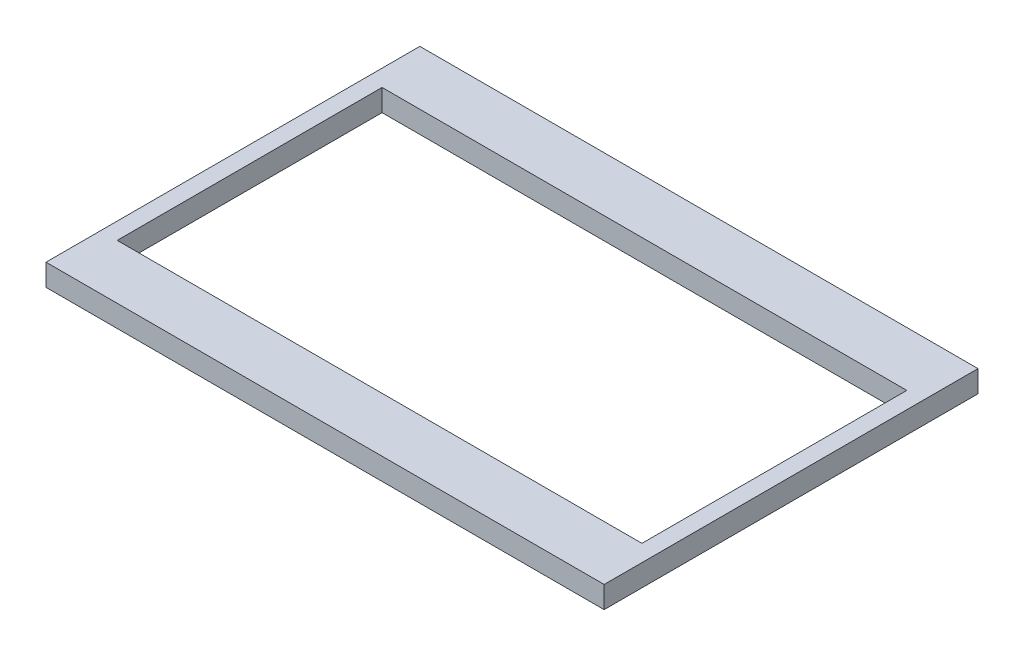
from build123d import *

# Parameters (mm, degrees)
SKETCH1_W           = 127.8
SKETCH1_H           = 85.6
BOSS_EXTRUDE1_DEPTH = 5
SKETCH2_W           = 120.15
SKETCH2_H           = 60.65
CUT_EXTRUDE1_DEPTH  = 5


with BuildPart() as part:
    # Sketch1 → Boss-Extrude1 (new body)
    with BuildSketch(Plane(origin=(0, 0, 0), x_dir=(1, 0, 0), z_dir=(0, 1, 0))):
        Rectangle(SKETCH1_W, SKETCH1_H)
    extrude(amount=BOSS_EXTRUDE1_DEPTH)

    # Sketch2 → Cut-Extrude1 (cut)
    with BuildSketch(Plane(origin=(0, 5, 0), x_dir=(1, 0, 0), z_dir=(0, 1, 0))):
        Rectangle(SKETCH2_W, SKETCH2_H)
    extrude(amount=-CUT_EXTRUDE1_DEPTH, mode=Mode.SUBTRACT)


solid = part.part
